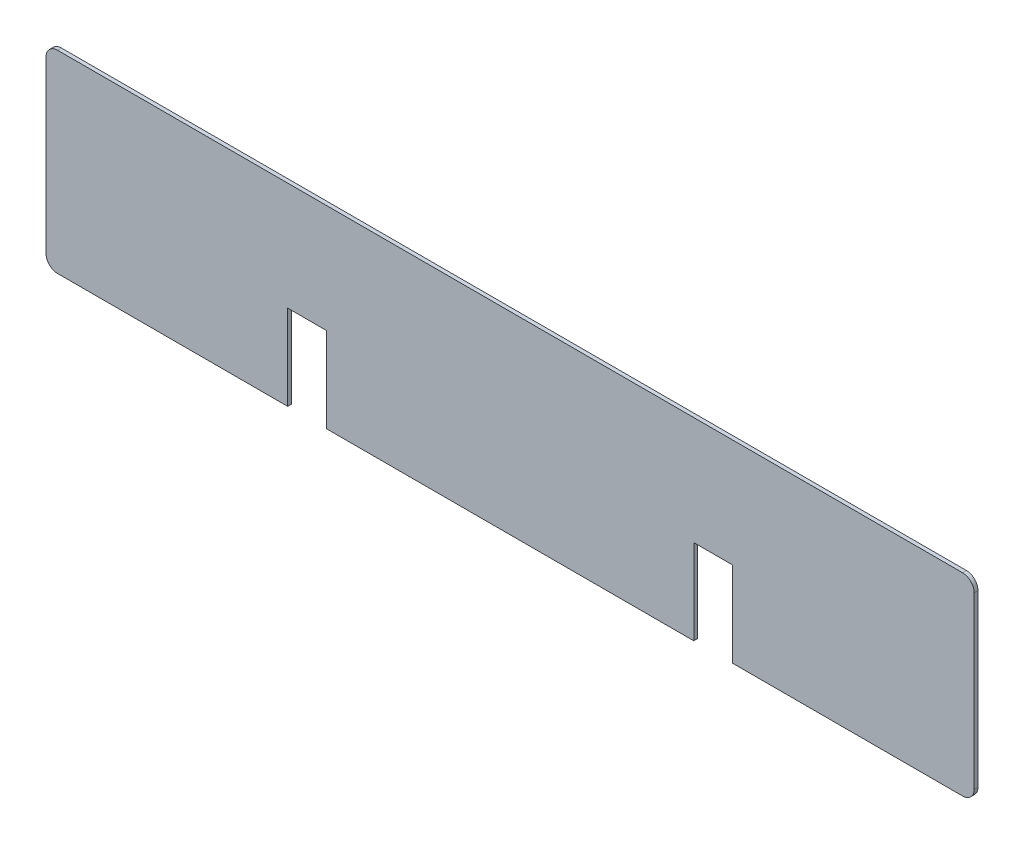
from build123d import *

# Parameters (mm, degrees)
SKETCH_1_W          = 240
SKETCH_1_H          = 50
EXTRUDE_1_DEPTH     = 1
FILLET_1_R          = 3
SKETCH_2_W          = 10
SKETCH_2_H          = 22
CUT_EXTRUDE_1_DEPTH = 123.580585739


with BuildPart() as part:
    # 草图1 → 凸台-拉伸1 (new body)
    with BuildSketch(Plane.XY):
        Rectangle(SKETCH_1_W, SKETCH_1_H)
    extrude(amount=EXTRUDE_1_DEPTH)

    # 圆角1
    fillet_1_edges = [part.edges().sort_by_distance(p)[0] for p in [
        (120, -25, 0.5),
        (-120, -25, 0.5),
        (-120, 25, 0.5),
        (120, 25, 0.5),
    ]]
    fillet(fillet_1_edges, radius=FILLET_1_R)

    # 草图2 → 切除-拉伸1 (cut, through all)
    with BuildSketch(Plane.XY.offset(1)):
        with Locations((-52.5, -14)):
            Rectangle(SKETCH_2_W, SKETCH_2_H)
        with Locations((52.5, -14)):
            Rectangle(SKETCH_2_W, SKETCH_2_H)
    extrude(amount=-CUT_EXTRUDE_1_DEPTH, mode=Mode.SUBTRACT)


solid = part.part
